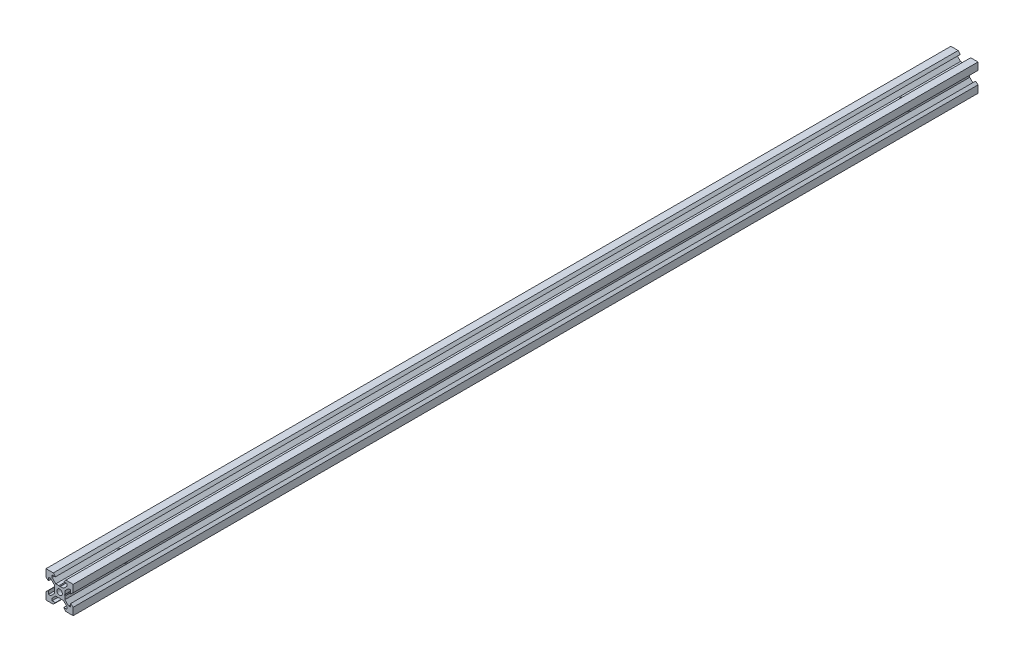
from build123d import *

# Parameters (mm, degrees)
SKETCH1_R               = 2
BOSS_EXTRUDE1_DEPTH     = 666
CUT_EXTRUDE1_DEPTH      = 667.220091261
CUT_EXTRUDE1_DEPTH_BACK = 667.220091261
SKETCH2_R               = 2
CUT_EXTRUDE2_DEPTH      = 667.220091261
CUT_EXTRUDE2_DEPTH_BACK = 667.220091261
SKETCH3_R               = 2


with BuildPart() as part:
    # Sketch1 → Boss-Extrude1 (new body)
    with BuildSketch(Plane.XY):
        Polygon((10, 10), (10, 4.610379336), (8.2, 3.1), (8.2, 5.5), (6.560660172, 5.5), (3.9, 2.839339828), (3.9, 0.519615242), (3.6, 0), (3.9, -0.519615242), (3.9, -2.839339828), (6.560660172, -5.5), (8.2, -5.5), (8.2, -3.1), (10, -4.610379336), (10, -10), (4.610379336, -10), (3.1, -8.2), (5.5, -8.2), (5.5, -6.560660172), (2.839339828, -3.9), (0.519615242, -3.9), (0, -3.6), (-0.519615242, -3.9), (-2.839339828, -3.9), (-5.5, -6.560660172), (-5.5, -8.2), (-3.1, -8.2), (-4.610379336, -10), (-10, -10), (-10, -4.610379336), (-8.2, -3.1), (-8.2, -5.5), (-6.560660172, -5.5), (-3.9, -2.839339828), (-3.9, -0.519615242), (-3.6, 0), (-3.9, 0.519615242), (-3.9, 2.839339828), (-6.560660172, 5.5), (-8.2, 5.5), (-8.2, 3.1), (-10, 4.610379336), (-10, 10), (-4.610379336, 10), (-3.1, 8.2), (-5.5, 8.2), (-5.5, 6.560660172), (-2.839339828, 3.9), (-0.519615242, 3.9), (0, 3.6), (0.519615242, 3.9), (2.839339828, 3.9), (5.5, 6.560660172), (5.5, 8.2), (3.1, 8.2), (4.610379336, 10), align=None)
        Circle(SKETCH1_R, mode=Mode.SUBTRACT)
    extrude(amount=BOSS_EXTRUDE1_DEPTH)

    # Sketch2 → Cut-Extrude1 (cut, two sides: drawn at the far end of the back side and taken through both)
    with BuildSketch(Plane(origin=(0, -3.9, 0), x_dir=(-1, 0, 0), z_dir=(0, -1, 0)).offset(-CUT_EXTRUDE1_DEPTH_BACK)):
        with Locations(Location((0, -621, 0), (0, 0, 90))):
            Circle(SKETCH2_R)
        with Locations(Location((0, -45, 0), (0, 0, 90))):
            Circle(SKETCH2_R)
    extrude(amount=CUT_EXTRUDE1_DEPTH + CUT_EXTRUDE1_DEPTH_BACK, mode=Mode.SUBTRACT)

    # Sketch3 → Cut-Extrude2 (cut, two sides: drawn at the far end of the back side and taken through both)
    with BuildSketch(Plane(origin=(3.9, 0, 0), x_dir=(0, 0, -1), z_dir=(1, 0, 0)).offset(-CUT_EXTRUDE2_DEPTH_BACK)):
        with Locations(Location((-45, 0, 0), (0, 0, 45))):
            Circle(SKETCH3_R)
        with Locations(Location((-621, 0, 0), (0, 0, 45))):
            Circle(SKETCH3_R)
    extrude(amount=CUT_EXTRUDE2_DEPTH + CUT_EXTRUDE2_DEPTH_BACK, mode=Mode.SUBTRACT)


solid = part.part
